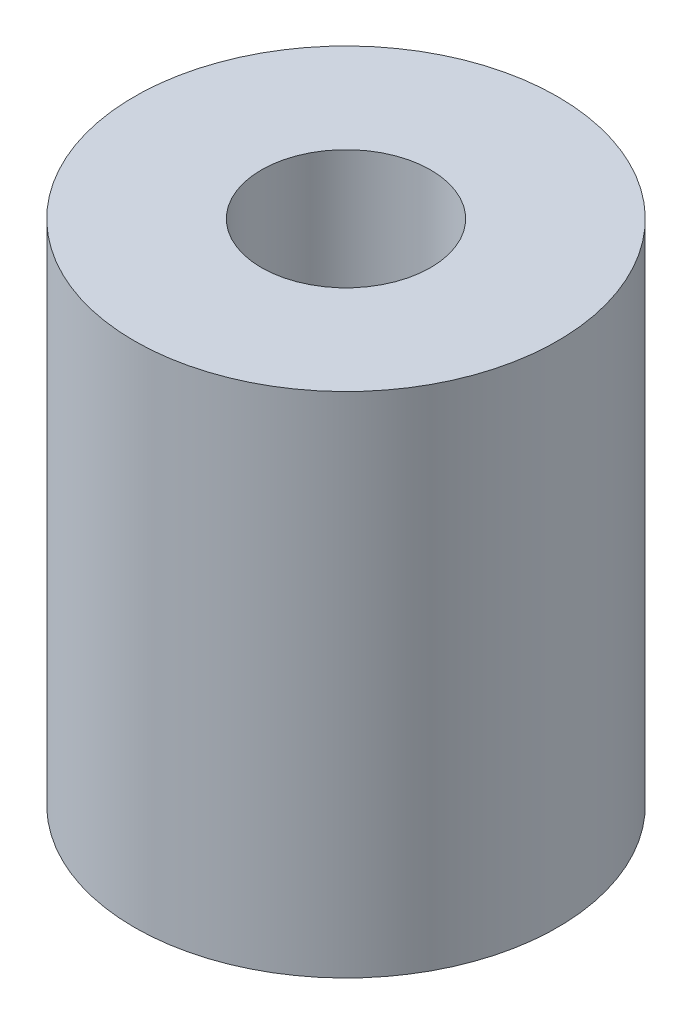
from build123d import *

# Parameters (mm, degrees)
SKETCH1_R           = 2.5
SKETCH1_R_2         = 1
BOSS_EXTRUDE1_DEPTH = 6


with BuildPart() as part:
    # Sketch1 → Boss-Extrude1 (new body)
    with BuildSketch(Plane(origin=(0, 0, 0), x_dir=(1, 0, 0), z_dir=(0, 1, 0))):
        with Locations(Location((0, 0, 0), (0, 0, 270))):
            Circle(SKETCH1_R)
        with Locations(Location((0, 0, 0), (0, 0, 270))):
            Circle(SKETCH1_R_2, mode=Mode.SUBTRACT)
    extrude(amount=BOSS_EXTRUDE1_DEPTH)


solid = part.part
